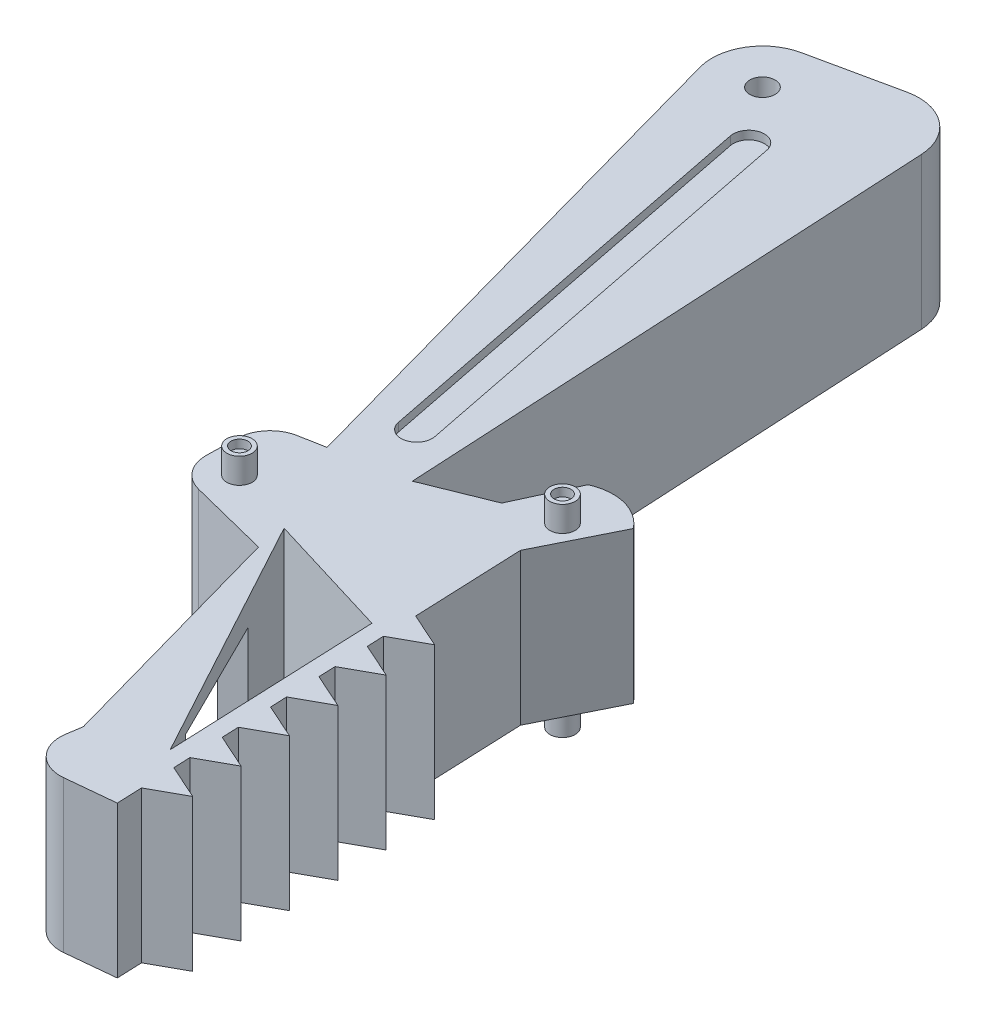
from build123d import *

# Parameters (mm, degrees)
BOSS_EXTRUDE2_DEPTH = 9
FILLET2_R           = 6
FILLET3_R           = 4
BOSS_EXTRUDE3_DEPTH = 18
LPATTERN1_COUNT     = 6
LPATTERN1_PITCH     = 6
CUT_EXTRUDE1_DEPTH  = 26
CUT_EXTRUDE2_DEPTH  = 8
SKETCH6_R           = 1.5
CUT_EXTRUDE3_DEPTH  = 141.270424647
SKETCH7_R           = 1.5
BOSS_EXTRUDE4_DEPTH = 3
SKETCH8_R           = 1
CUT_EXTRUDE4_DEPTH  = 1
SKETCH9_R           = 1
CUT_EXTRUDE5_DEPTH  = 1
CUT_EXTRUDE6_DEPTH  = 1


with BuildPart() as part:
    # Sketch2 → Boss-Extrude2 (new, symmetric)
    with BuildSketch(Plane(origin=(0, 0, 0), x_dir=(1, 0, 0), z_dir=(0, 1, 0))):
        with BuildLine():
            ThreePointArc((-29.221908411, -61.269670629), (-25.308747509, -60.930081396), (-22.024034304, -63.083870674))
            Line((-22.024034304, -63.083870674), (-26.48393122, -72.034251644))
            Line((-26.48393122, -72.034251644), (-24.427510733, -121.991945093))
            Line((-24.427510733, -121.991945093), (-35.374328657, -123.072304919))
            Line((-35.374328657, -123.072304919), (-34.306141095, -116.154286754))
            Line((-34.306141095, -116.154286754), (-42.387240047, -87.26318363))
            Line((-42.387240047, -87.26318363), (-54.992342236, -84.083341057))
            Line((-54.992342236, -84.083341057), (-54.772056901, -74.085767632))
            Line((-54.772056901, -74.085767632), (-40.025552486, -71.339750966))
            Line((-40.025552486, -71.339750966), (-32.461637172, -68.287082299))
            Line((-32.461637172, -68.287082299), (-29.221908411, -61.269670629))
        make_face()
        Polygon((-40.025552486, -71.339750966), (-43.775331208, -0.438840115), (-67.242664489, -5.467186629), (-48.571202968, -72.931077154), align=None)
    extrude(amount=BOSS_EXTRUDE2_DEPTH, both=True)

    # Fillet2
    fillet2_edges = [part.edges().sort_by_distance(p)[0] for p in [
        (-67.242664489, 0, 5.467186629),
        (-43.775331208, 0, 0.438840115),
    ]]
    fillet(fillet2_edges, radius=FILLET2_R)

    # Fillet3
    fillet3_edges = [part.edges().sort_by_distance(p)[0] for p in [
        (-35.374328657, 0, 123.072304919),
        (-54.992342236, 0, 84.083341057),
        (-54.772056901, 0, 74.085767632),
    ]]
    fillet(fillet3_edges, radius=FILLET3_R)

    # Sketch3 → Boss-Extrude3 (add)
    with BuildSketch(Plane(origin=(0, 9, 0), x_dir=(1, 0, 0), z_dir=(0, 1, 0))):
        Polygon((-24.715653408, -114.991945093), (-24.633326929, -116.991945093), (-20.633326929, -116.827292136), align=None)
        Polygon((-24.633326929, -116.991945093), (-24.551000451, -118.991945093), (-20.633326929, -116.827292136), align=None)
    boss_extrude3 = extrude(amount=-BOSS_EXTRUDE3_DEPTH)

    # LPattern1: Boss-Extrude3 ×6
    with Locations(*[Vector(-0.04112840973087357, 0, -0.9991538689876598) * (i * LPATTERN1_PITCH) for i in range(1, LPATTERN1_COUNT)]):
        add(boss_extrude3)

    # Sketch4 → Cut-Extrude1 (cut)
    with BuildSketch(Plane(origin=(0, 9, 0), x_dir=(1, 0, 0), z_dir=(0, 1, 0))):
        Polygon((-26.777262548, -113.360971375), (-27.806343529, -88.360971375), (-42.806343529, -83.797470899), align=None)
    extrude(amount=-CUT_EXTRUDE1_DEPTH, mode=Mode.SUBTRACT)

    # Sketch5 → Cut-Extrude2 (cut)
    with BuildSketch(Plane(origin=(-61.948834437, 0, 17.327640931), x_dir=(0.2693699650610515, 0, 0.9630367708052524), z_dir=(-0.9630367708052524, 0, 0.2693699650610515))):
        Polygon((79.619805202, 6), (79.619805202, -6), (97.619805202, -7.510612388), (97.619805202, 7.510612388), align=None)
    extrude(amount=-CUT_EXTRUDE2_DEPTH, mode=Mode.SUBTRACT)

    # Sketch6 → Cut-Extrude3 (cut, through all)
    with BuildSketch(Plane(origin=(0, 9, 0), x_dir=(1, 0, 0), z_dir=(0, 1, 0))):
        with Locations(Location((-59.762437454, -10.000587386, 0), (0, 0, 270))):
            Circle(SKETCH6_R)
    extrude(amount=-CUT_EXTRUDE3_DEPTH, mode=Mode.SUBTRACT)

    # Sketch7 → Boss-Extrude4 (add)
    with BuildSketch(Plane(origin=(0, 9, 0), x_dir=(1, 0, 0), z_dir=(0, 1, 0))):
        with Locations(Location((-26.77516561, -66.748123847, 0), (0, 0, 270))):
            Circle(SKETCH7_R)
        with Locations(Location((-50.92309324, -80.984561831, 0), (0, 0, 270))):
            Circle(SKETCH7_R)
    boss_extrude4 = extrude(amount=BOSS_EXTRUDE4_DEPTH)

    # Sketch8 → Cut-Extrude4 (cut)
    with BuildSketch(Plane(origin=(0, 12, 0), x_dir=(1, 0, 0), z_dir=(0, 1, 0))):
        with Locations(Location((-50.92309324, -80.984561831, 0), (0, 0, 270))):
            Circle(SKETCH8_R)
    cut_extrude4 = extrude(amount=-CUT_EXTRUDE4_DEPTH, mode=Mode.SUBTRACT)

    # Sketch9 → Cut-Extrude5 (cut)
    with BuildSketch(Plane(origin=(0, 12, 0), x_dir=(1, 0, 0), z_dir=(0, 1, 0))):
        with Locations(Location((-26.77516561, -66.748123847, 0), (0, 0, 270))):
            Circle(SKETCH9_R)
    cut_extrude5 = extrude(amount=-CUT_EXTRUDE5_DEPTH, mode=Mode.SUBTRACT)

    # Sketch10 → Cut-Extrude6 (cut)
    with BuildSketch(Plane(origin=(0, 9, 0), x_dir=(1, 0, 0), z_dir=(0, 1, 0))):
        with BuildLine():
            Line((-53.032104668, -16.184151081), (-43.273460306, -65.40538361))
            ThreePointArc((-43.273460306, -65.40538361), (-44.729227788, -67.581140215), (-46.904984392, -66.125372733))
            Line((-46.904984392, -66.125372733), (-56.663628755, -16.904140204))
            ThreePointArc((-56.663628755, -16.904140204), (-55.207861273, -14.728383599), (-53.032104668, -16.184151081))
        make_face()
    cut_extrude6 = extrude(amount=-CUT_EXTRUDE6_DEPTH, mode=Mode.SUBTRACT)

    # Mirror1: Boss-Extrude4, Cut-Extrude4, Cut-Extrude5, Cut-Extrude6 across plane
    add(boss_extrude4.mirror(Plane.ZX))
    add(cut_extrude4.mirror(Plane.ZX), mode=Mode.SUBTRACT)
    add(cut_extrude5.mirror(Plane.ZX), mode=Mode.SUBTRACT)
    add(cut_extrude6.mirror(Plane.ZX), mode=Mode.SUBTRACT)


solid = part.part
